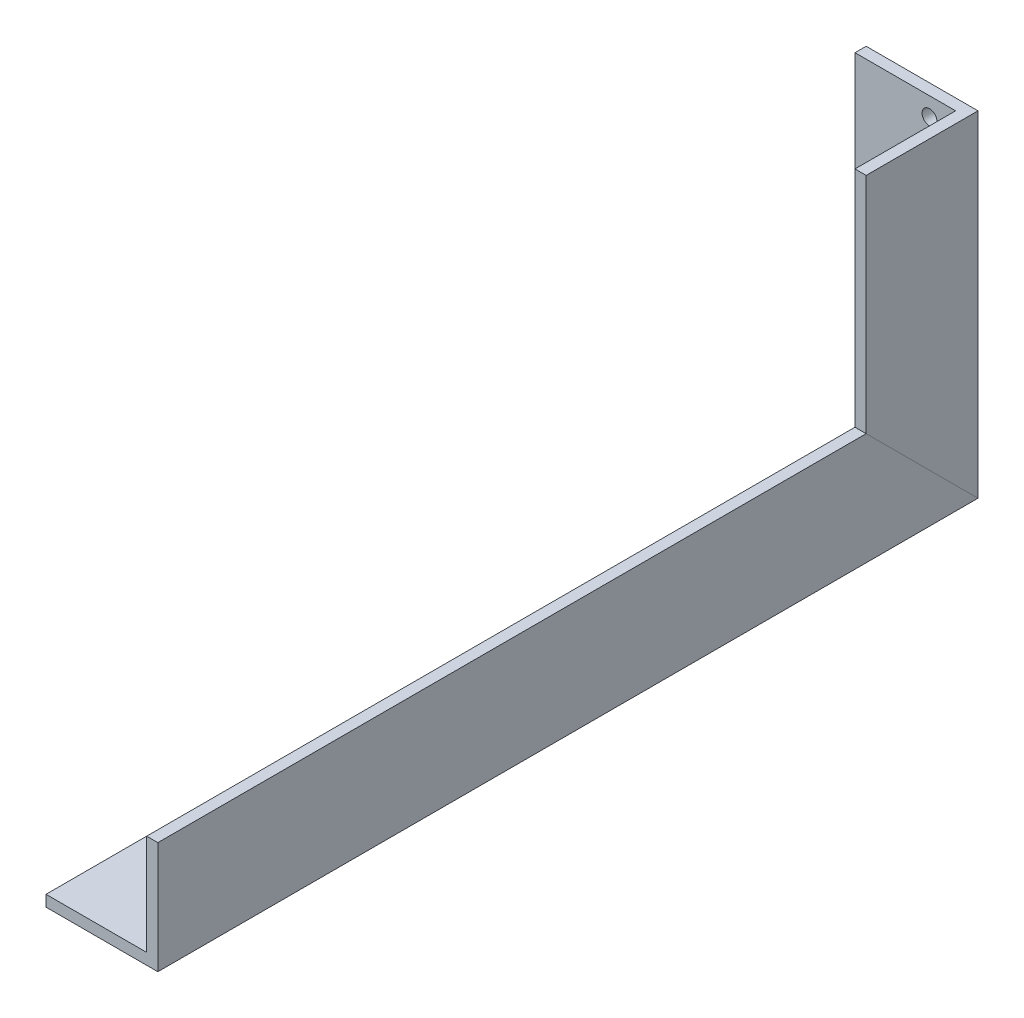
from build123d import *

# Parameters (mm, degrees)
SKETCH7_R          = 2
CUT_EXTRUDE1_DEPTH = 10


with BuildPart() as part:
    # Sweep1: sweep along a path in Sketch4
    with BuildLine(Plane(origin=(0, 0, 0), x_dir=(0, 0, -1), z_dir=(1, 0, 0))) as sweep1_path:
        Line((0, 0), (220, 0))
        Line((220, 0), (220, 90))
    # Sketch2 → Sweep1 (sweep)
    with BuildSketch(Plane.XY):
        Polygon((0, 0), (30, 0), (30, 30), (27, 30), (27, 3), (0, 3), align=None)
    sweep(path=sweep1_path.line, transition=Transition.RIGHT)

    # Sketch7 → Cut-Extrude1 (cut)
    with BuildSketch(Plane(origin=(0, 0, -220), x_dir=(-1, 0, 0), z_dir=(0, 0, -1))):
        with Locations((-20, 85)):
            Circle(SKETCH7_R)
    extrude(amount=-CUT_EXTRUDE1_DEPTH, mode=Mode.SUBTRACT)


solid = part.part
